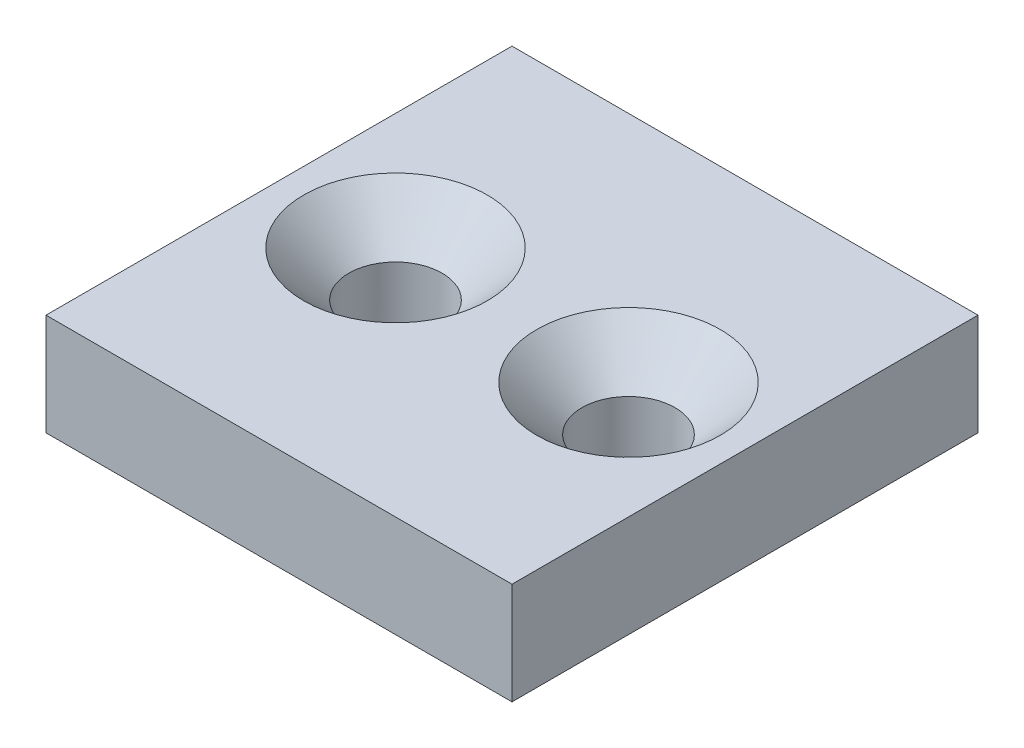
from build123d import *

# Parameters (mm, degrees)
SKETCH1_W                                       = 32
SKETCH1_H                                       = 32
BOSS_EXTRUDE1_DEPTH                             = 7
CSK_FOR_M6_FLAT_HEAD_MACHINE_SCREW1_D           = 6.4
CSK_FOR_M6_FLAT_HEAD_MACHINE_SCREW1_CSINK_D     = 12.6
CSK_FOR_M6_FLAT_HEAD_MACHINE_SCREW1_CSINK_ANGLE = 90


with BuildPart() as part:
    # Sketch1 → Boss-Extrude1 (new body)
    with BuildSketch(Plane(origin=(0, 0, 0), x_dir=(1, 0, 0), z_dir=(0, 1, 0))):
        Rectangle(SKETCH1_W, SKETCH1_H)
    extrude(amount=BOSS_EXTRUDE1_DEPTH)

    # CSK for M6 Flat Head Machine Screw1 (through all)
    with Locations(Plane(origin=(0, 7, 0), x_dir=(1, 0, 0), z_dir=(0, 1, 0))):
        with Locations((8, 0), (-8, 0)):
            CounterSinkHole(CSK_FOR_M6_FLAT_HEAD_MACHINE_SCREW1_D / 2, CSK_FOR_M6_FLAT_HEAD_MACHINE_SCREW1_CSINK_D / 2, counter_sink_angle=CSK_FOR_M6_FLAT_HEAD_MACHINE_SCREW1_CSINK_ANGLE)


solid = part.part
